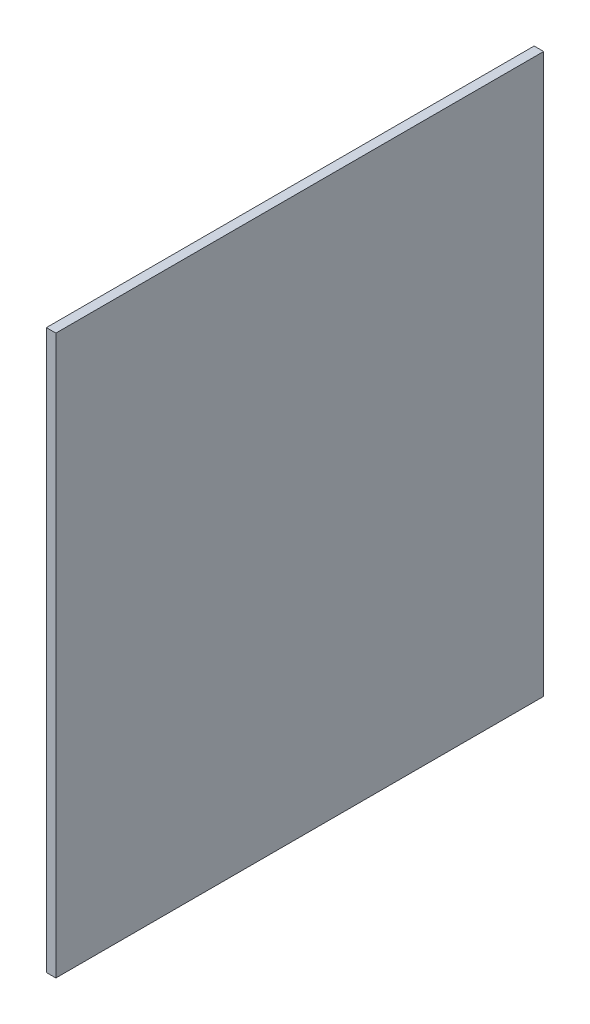
from build123d import *

# Parameters (mm, degrees)
SKETCH1_W           = 130.3
SKETCH1_H           = 149.2
BOSS_EXTRUDE1_DEPTH = 2.54


with BuildPart() as part:
    # Sketch1 → Boss-Extrude1 (new body)
    with BuildSketch(Plane(origin=(0, 0, 0), x_dir=(0, 0, -1), z_dir=(1, 0, 0))):
        with Locations((65.15, 74.6)):
            Rectangle(SKETCH1_W, SKETCH1_H)
    extrude(amount=BOSS_EXTRUDE1_DEPTH)


solid = part.part
